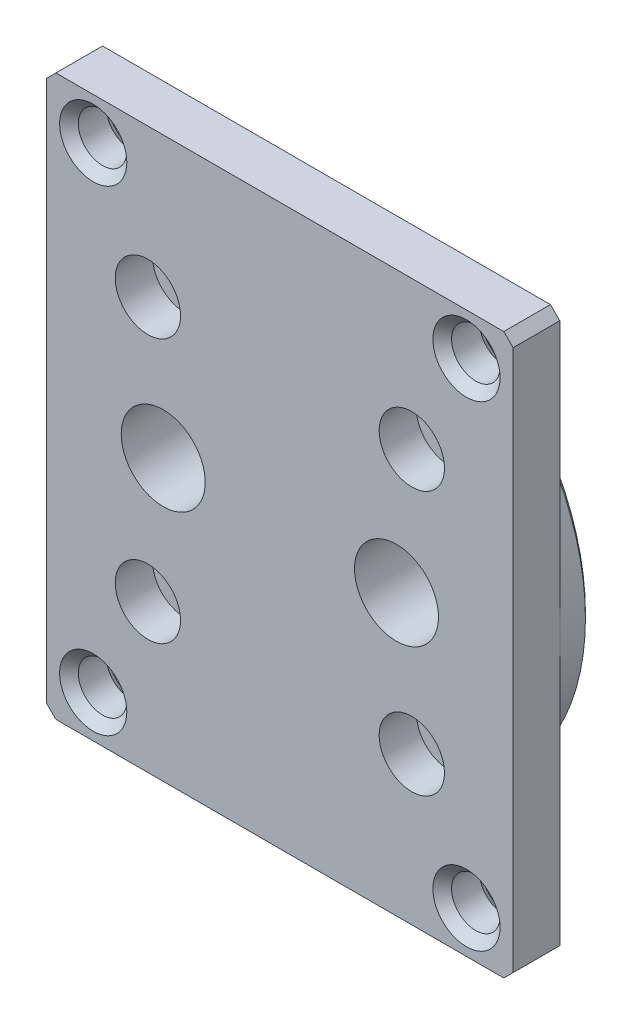
from build123d import *

# Parameters (mm, degrees)
SKETCH1_R           = 25
BOSS_EXTRUDE1_DEPTH = 8.25
SKETCH2_W           = 50
SKETCH2_H           = 50
BOSS_EXTRUDE2_DEPTH = 5
SKETCH3_R           = 4.5
SKETCH3_R_2         = 1.75
CUT_EXTRUDE1_DEPTH  = 37.305130491
SKETCH5_R           = 3.5
CUT_EXTRUDE3_DEPTH  = 4
CIRPATTERN2_COUNT   = 4
CHAMFER2_SIZE       = 0.5
SKETCH6_W           = 50
SKETCH6_H           = 5
BOSS_EXTRUDE3_DEPTH = 5
SKETCH7_R           = 2.6
CUT_EXTRUDE4_DEPTH  = 40.37003937
CHAMFER3_SIZE       = 1


with BuildPart() as part:
    # Sketch1 → Boss-Extrude1 (new body)
    with BuildSketch(Plane.XY):
        Circle(SKETCH1_R)
    extrude(amount=BOSS_EXTRUDE1_DEPTH)

    # Sketch2 → Boss-Extrude2 (add)
    with BuildSketch(Plane.XY.offset(8.25)):
        Rectangle(SKETCH2_W, SKETCH2_H)
    extrude(amount=-BOSS_EXTRUDE2_DEPTH)

    # Sketch3 → Cut-Extrude1 (cut, through all)
    with BuildSketch(Plane(origin=(0, 0, 0), x_dir=(-1, 0, 0), z_dir=(0, 0, -1))):
        with Locations((12.5, 0)):
            Circle(SKETCH3_R)
        with Locations((-12.5, 0)):
            Circle(SKETCH3_R)
        with Locations((-14.142135624, 14.142135624)):
            Circle(SKETCH3_R_2)
        with Locations((14.142135624, 14.142135624)):
            Circle(SKETCH3_R_2)
        with Locations((14.142135624, -14.142135624)):
            Circle(SKETCH3_R_2)
        with Locations((-14.142135624, -14.142135624)):
            Circle(SKETCH3_R_2)
    extrude(amount=-CUT_EXTRUDE1_DEPTH, mode=Mode.SUBTRACT)

    # Sketch5 → Cut-Extrude3 (cut)
    with BuildSketch(Plane.XY.offset(8.25)):
        with Locations((-14.142135624, 14.142135624)):
            Circle(SKETCH5_R)
    cut_extrude3 = extrude(amount=-CUT_EXTRUDE3_DEPTH, mode=Mode.SUBTRACT)

    # CirPattern2: Cut-Extrude3 ×4 about axis
    cirpattern2_axis = Axis((0, 0, 0), (0, 0, 1))
    for i in range(1, CIRPATTERN2_COUNT):
        add(cut_extrude3.rotate(cirpattern2_axis, i * 360 / CIRPATTERN2_COUNT), mode=Mode.SUBTRACT)

    # Chamfer2
    chamfer2_edges = [part.edges().sort_by_distance(p)[0] for p in [
        (-25, 0, 0),
        (17, 0, 0),
        (15.892135624, 14.142135624, 0),
        (-12.392135624, 14.142135624, 0),
        (-12.392135624, -14.142135624, 0),
        (15.892135624, -14.142135624, 0),
        (-8, 0, 0),
    ]]
    chamfer(chamfer2_edges, length=CHAMFER2_SIZE)

    # Sketch6 → Boss-Extrude3 (add)
    with BuildSketch(Plane.XY.offset(8.25)):
        with Locations((0, 27.5)):
            Rectangle(SKETCH6_W, SKETCH6_H)
        with Locations((0, -27.5)):
            Rectangle(SKETCH6_W, SKETCH6_H)
    extrude(amount=-BOSS_EXTRUDE3_DEPTH)

    # Sketch7 → Cut-Extrude4 (cut, through all)
    with BuildSketch(Plane(origin=(0, 0, 3.25), x_dir=(-1, 0, 0), z_dir=(0, 0, -1))):
        with Locations((-20, 25.5)):
            Circle(SKETCH7_R)
        with Locations((20, 25.5)):
            Circle(SKETCH7_R)
        with Locations((20, -25.5)):
            Circle(SKETCH7_R)
        with Locations((-20, -25.5)):
            Circle(SKETCH7_R)
    extrude(amount=-CUT_EXTRUDE4_DEPTH, mode=Mode.SUBTRACT)

    # Chamfer3
    chamfer3_edges = [part.edges().sort_by_distance(p)[0] for p in [
        (-25, 30, 5.75),
        (25, 30, 5.75),
        (-25, -30, 5.75),
        (25, -30, 5.75),
        (22.6, -25.5, 8.25),
        (22.6, -25.5, 3.25),
        (-17.4, -25.5, 8.25),
        (-17.4, -25.5, 3.25),
        (-17.4, 25.5, 8.25),
        (-17.4, 25.5, 3.25),
        (22.6, 25.5, 8.25),
        (22.6, 25.5, 3.25),
    ]]
    chamfer(chamfer3_edges, length=CHAMFER3_SIZE)


solid = part.part
